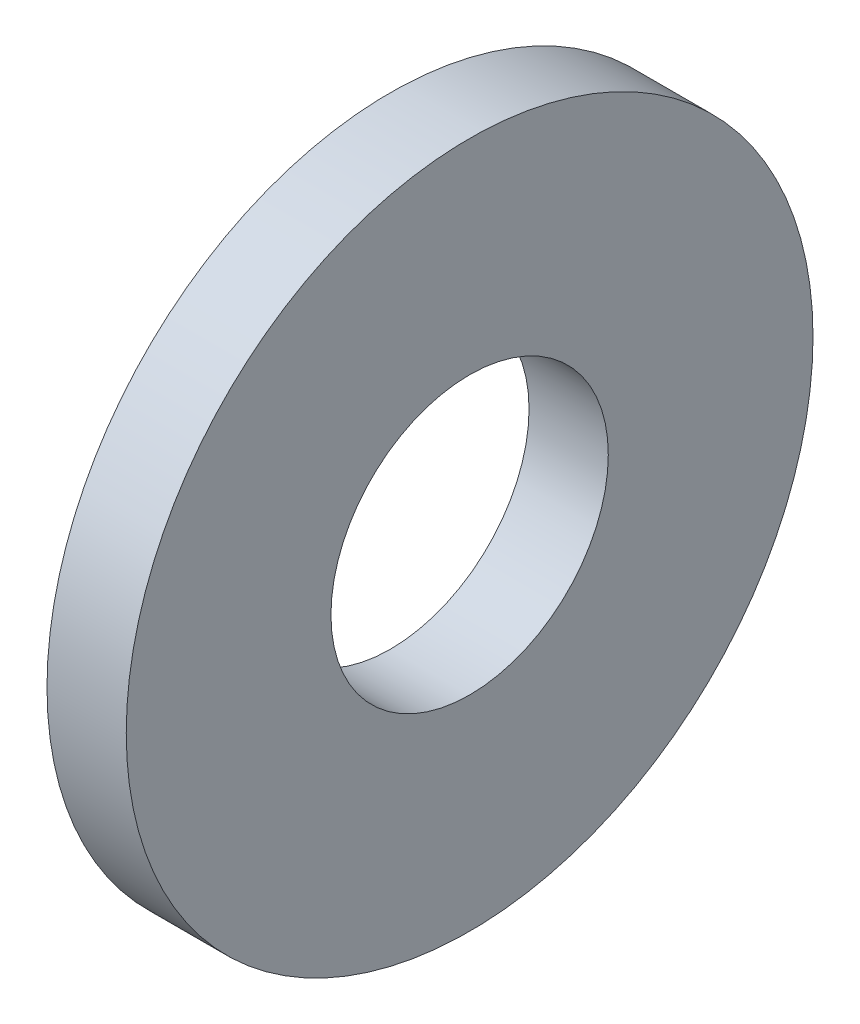
from build123d import *

# Parameters (mm, degrees)
SKETCH_1_R      = 13
SKETCH_1_R_2    = 5.25
EXTRUDE_1_DEPTH = 3


with BuildPart() as part:
    # 草图1 → 凸台-拉伸1 (new body)
    with BuildSketch(Plane(origin=(0, 0, 0), x_dir=(0, 0, -1), z_dir=(1, 0, 0))):
        Circle(SKETCH_1_R)
        Circle(SKETCH_1_R_2, mode=Mode.SUBTRACT)
    extrude(amount=EXTRUDE_1_DEPTH)


solid = part.part
